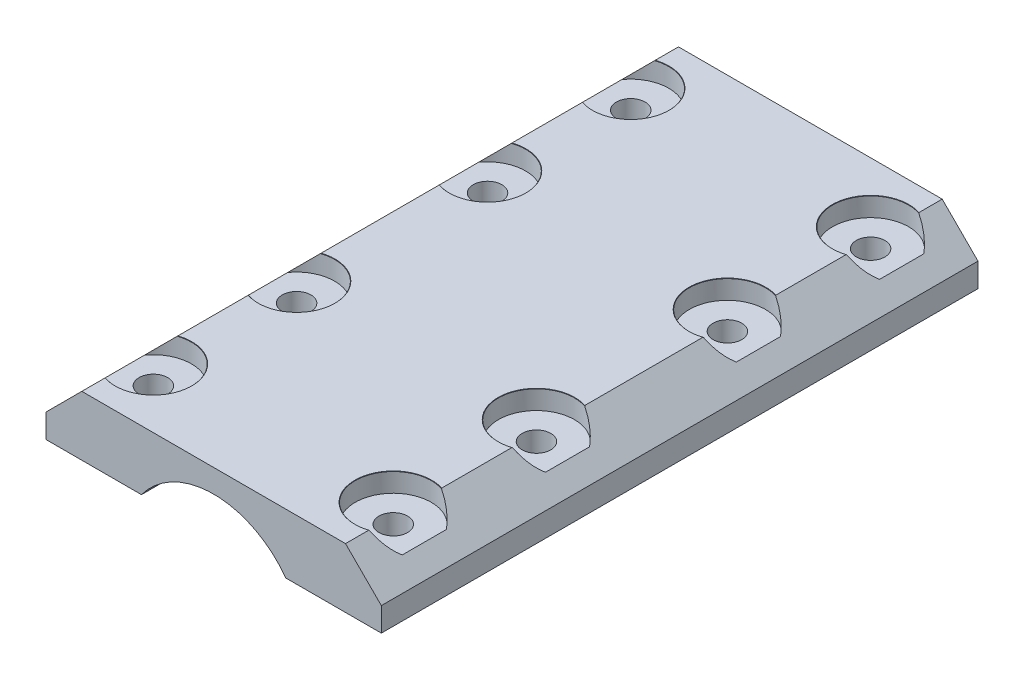
from build123d import *

# Parameters (mm, degrees)
SALIENTE_EXTRUIR1_DEPTH                       = 50
CHAFL_N2_SIZE                                 = 3
CBORE_FOR_M2_HEX_HEAD_MACHINE_SCREW1_AT_COUNT = 2
CBORE_FOR_M2_HEX_HEAD_MACHINE_SCREW1_AT_PITCH = 12
CBORE_FOR_M2_HEX_HEAD_MACHINE_SCREW1_2_COUNT  = 2
CBORE_FOR_M2_HEX_HEAD_MACHINE_SCREW1_2_PITCH  = 23.40961341
CBORE_FOR_M2_HEX_HEAD_MACHINE_SCREW1_3_COUNT  = 2
CBORE_FOR_M2_HEX_HEAD_MACHINE_SCREW1_3_PITCH  = 20.1
CBORE_FOR_M2_HEX_HEAD_MACHINE_SCREW1_4_COUNT  = 2
CBORE_FOR_M2_HEX_HEAD_MACHINE_SCREW1_4_PITCH  = 28
CBORE_FOR_M2_HEX_HEAD_MACHINE_SCREW1_5_COUNT  = 2
CBORE_FOR_M2_HEX_HEAD_MACHINE_SCREW1_5_PITCH  = 34.467520944
CBORE_FOR_M2_HEX_HEAD_MACHINE_SCREW1_6_COUNT  = 2
CBORE_FOR_M2_HEX_HEAD_MACHINE_SCREW1_6_PITCH  = 44.766170263
CBORE_FOR_M2_HEX_HEAD_MACHINE_SCREW1_7_COUNT  = 2
CBORE_FOR_M2_HEX_HEAD_MACHINE_SCREW1_7_PITCH  = 40


with BuildPart() as part:
    # Croquis1 → Saliente-Extruir1 (new body)
    with BuildSketch(Plane.XY):
        with BuildLine():
            Line((0, 0), (8, 0))
            ThreePointArc((8, 0), (14.05, 3.068493182), (20.1, 0))
            Line((20.1, 0), (28.1, 0))
            Line((28.1, 0), (28.1, 5))
            Line((28.1, 5), (0, 5))
            Line((0, 5), (0, 0))
        make_face()
    extrude(amount=SALIENTE_EXTRUIR1_DEPTH)

    # Chaflán2
    chafl_n2_edges = [part.edges().sort_by_distance(p)[0] for p in [
        (0, 5, 25),
        (28.1, 5, 25),
    ]]
    chamfer(chafl_n2_edges, length=CHAFL_N2_SIZE)

    # Croquis3 → CBORE for M2 Hex Head Machine Screw1 (revolve, cut)
    with BuildSketch(Plane(origin=(4, 5, 5), x_dir=(0, 0, 1), z_dir=(1, 0, 0))):
        Polygon((0, 0), (0, 7), (1.2, 6.278967257), (1.2, 1.6), (3.19, 1.6), (3.19, 0.025), (3.215, 0), align=None)
    cbore_for_m2_hex_head_machine_screw1 = revolve(axis=Axis((4, 11.35, 5), (0, -1, 0)), mode=Mode.SUBTRACT)

    # CBORE for M2 Hex Head Machine Screw1 at: CBORE for M2 Hex Head Machine Screw1 ×2
    with Locations(*[(0, 0, i * CBORE_FOR_M2_HEX_HEAD_MACHINE_SCREW1_AT_PITCH) for i in range(1, CBORE_FOR_M2_HEX_HEAD_MACHINE_SCREW1_AT_COUNT)]):
        add(cbore_for_m2_hex_head_machine_screw1, mode=Mode.SUBTRACT)

    # CBORE for M2 Hex Head Machine Screw1 2: CBORE for M2 Hex Head Machine Screw1 ×2
    with Locations(*[Vector(0.8586216119022935, 0, 0.5126099175535989) * (i * CBORE_FOR_M2_HEX_HEAD_MACHINE_SCREW1_2_PITCH) for i in range(1, CBORE_FOR_M2_HEX_HEAD_MACHINE_SCREW1_2_COUNT)]):
        add(cbore_for_m2_hex_head_machine_screw1, mode=Mode.SUBTRACT)

    # CBORE for M2 Hex Head Machine Screw1 3: CBORE for M2 Hex Head Machine Screw1 ×2
    with Locations(*[(i * CBORE_FOR_M2_HEX_HEAD_MACHINE_SCREW1_3_PITCH, 0, 0) for i in range(1, CBORE_FOR_M2_HEX_HEAD_MACHINE_SCREW1_3_COUNT)]):
        add(cbore_for_m2_hex_head_machine_screw1, mode=Mode.SUBTRACT)

    # CBORE for M2 Hex Head Machine Screw1 4: CBORE for M2 Hex Head Machine Screw1 ×2
    with Locations(*[(0, 0, i * CBORE_FOR_M2_HEX_HEAD_MACHINE_SCREW1_4_PITCH) for i in range(1, CBORE_FOR_M2_HEX_HEAD_MACHINE_SCREW1_4_COUNT)]):
        add(cbore_for_m2_hex_head_machine_screw1, mode=Mode.SUBTRACT)

    # CBORE for M2 Hex Head Machine Screw1 5: CBORE for M2 Hex Head Machine Screw1 ×2
    with Locations(*[Vector(0.5831576930893619, 0, 0.8123589754478582) * (i * CBORE_FOR_M2_HEX_HEAD_MACHINE_SCREW1_5_PITCH) for i in range(1, CBORE_FOR_M2_HEX_HEAD_MACHINE_SCREW1_5_COUNT)]):
        add(cbore_for_m2_hex_head_machine_screw1, mode=Mode.SUBTRACT)

    # CBORE for M2 Hex Head Machine Screw1 6: CBORE for M2 Hex Head Machine Screw1 ×2
    with Locations(*[Vector(0.44899976660931423, 0, 0.8935318738493784) * (i * CBORE_FOR_M2_HEX_HEAD_MACHINE_SCREW1_6_PITCH) for i in range(1, CBORE_FOR_M2_HEX_HEAD_MACHINE_SCREW1_6_COUNT)]):
        add(cbore_for_m2_hex_head_machine_screw1, mode=Mode.SUBTRACT)

    # CBORE for M2 Hex Head Machine Screw1 7: CBORE for M2 Hex Head Machine Screw1 ×2
    with Locations(*[(0, 0, i * CBORE_FOR_M2_HEX_HEAD_MACHINE_SCREW1_7_PITCH) for i in range(1, CBORE_FOR_M2_HEX_HEAD_MACHINE_SCREW1_7_COUNT)]):
        add(cbore_for_m2_hex_head_machine_screw1, mode=Mode.SUBTRACT)


solid = part.part
